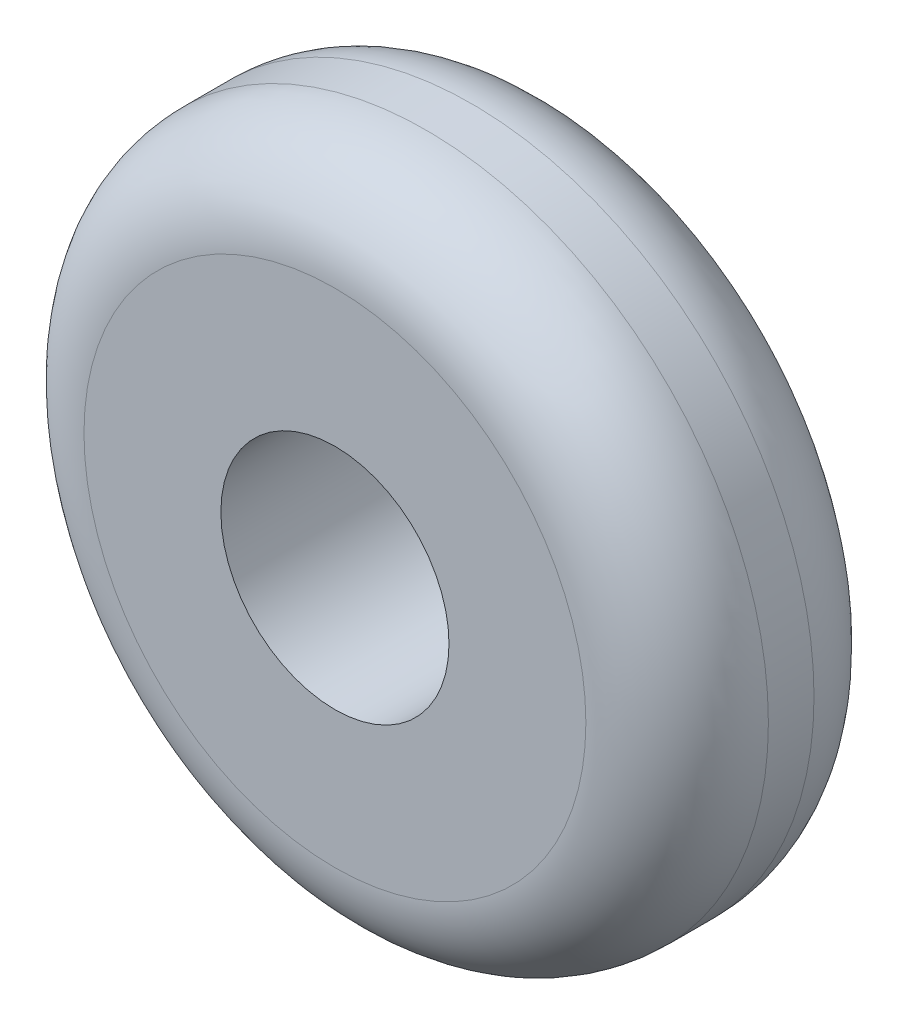
from build123d import *

# Parameters (mm, degrees)
SKETCH1_R           = 7.5
SKETCH1_R_2         = 2.5
BOSS_EXTRUDE1_DEPTH = 5
FILLET6_R           = 2


with BuildPart() as part:
    # Sketch1 → Boss-Extrude1 (new body)
    with BuildSketch(Plane.XY):
        Circle(SKETCH1_R)
        Circle(SKETCH1_R_2, mode=Mode.SUBTRACT)
    extrude(amount=BOSS_EXTRUDE1_DEPTH)

    # Fillet6
    fillet6_edges = [part.edges().sort_by_distance(p)[0] for p in [
        (-7.5, 0, 0),
        (-7.5, 0, 5),
    ]]
    fillet(fillet6_edges, radius=FILLET6_R)


solid = part.part
